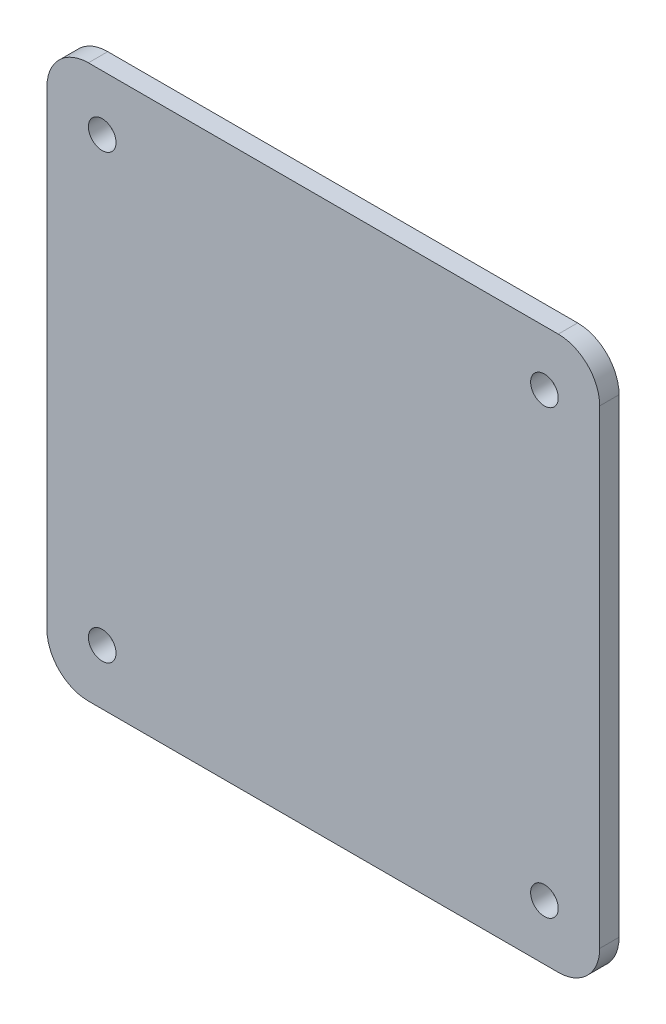
from build123d import *

# Parameters (mm, degrees)
ESQUISSE3_W        = 200
ESQUISSE3_H        = 200
ESQUISSE3_R        = 5
BOSS_EXTRU_2_DEPTH = 7
CONG_1_R           = 15


with BuildPart() as part:
    # Esquisse3 → Boss.-Extru.2 (new body)
    with BuildSketch(Plane.XY):
        Rectangle(ESQUISSE3_W, ESQUISSE3_H)
        with Locations((80, 80)):
            Circle(ESQUISSE3_R, mode=Mode.SUBTRACT)
        with Locations((80, -80)):
            Circle(ESQUISSE3_R, mode=Mode.SUBTRACT)
        with Locations((-80, -80)):
            Circle(ESQUISSE3_R, mode=Mode.SUBTRACT)
        with Locations((-80, 80)):
            Circle(ESQUISSE3_R, mode=Mode.SUBTRACT)
    extrude(amount=BOSS_EXTRU_2_DEPTH)

    # Congé1
    cong_1_edges = [part.edges().sort_by_distance(p)[0] for p in [
        (-100, 100, 3.5),
        (100, 100, 3.5),
        (100, -100, 3.5),
        (-100, -100, 3.5),
    ]]
    fillet(cong_1_edges, radius=CONG_1_R)


solid = part.part
